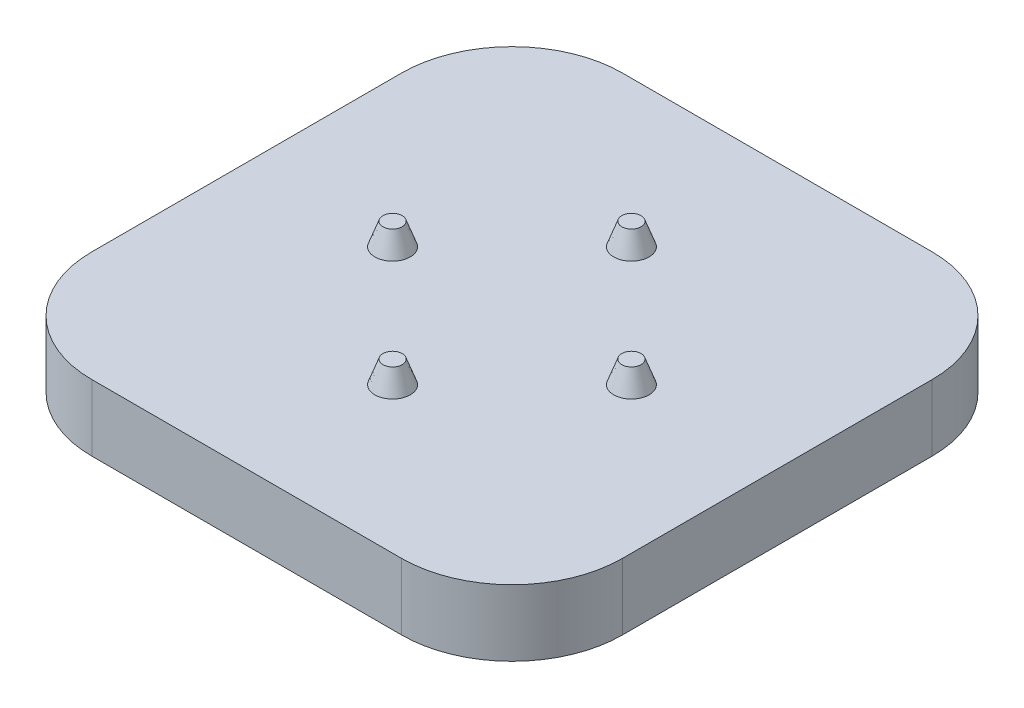
from build123d import *

# Parameters (mm, degrees)
CROQUIS2_W                        = 12
CROQUIS2_H                        = 12
PLATAFORMA_DEPTH                  = 1.5
REDONDEO3_R                       = 2.5
CROQUIS16_R                       = 0.4
SALIENTE_EXTRUIR7_DEPTH           = 0.5
SALIENTE_EXTRUIR7_DRAFT           = 20
SALIENTE_EXTRUIR7_PROFILE_2_DEPTH = 0.5
SALIENTE_EXTRUIR7_PROFILE_2_DRAFT = 20
SALIENTE_EXTRUIR7_PROFILE_3_DEPTH = 0.5
SALIENTE_EXTRUIR7_PROFILE_3_DRAFT = 20
SALIENTE_EXTRUIR7_PROFILE_4_DEPTH = 0.5
SALIENTE_EXTRUIR7_PROFILE_4_DRAFT = 20
ESCALA1_SCALE                     = 10


with BuildPart() as part:
    # Croquis2 → Plataforma (new body)
    with BuildSketch(Plane(origin=(0, 0, 0), x_dir=(1, 0, 0), z_dir=(0, 1, 0))):
        Rectangle(CROQUIS2_W, CROQUIS2_H)
    extrude(amount=PLATAFORMA_DEPTH)

    # Redondeo3
    redondeo3_edges = [part.edges().sort_by_distance(p)[0] for p in [
        (-6, 0.75, -6),
        (6, 0.75, -6),
        (6, 0.75, 6),
        (-6, 0.75, 6),
    ]]
    fillet(redondeo3_edges, radius=REDONDEO3_R)


with BuildPart() as saliente_extruir7_tool:
    # Croquis16 → Saliente-Extruir7 (with draft: the straight prism first)
    with BuildSketch(Plane(origin=(0, 1.5, 0), x_dir=(1, 0, 0), z_dir=(0, 1, 0))):
        with Locations((-2.7, 0)):
            Circle(CROQUIS16_R)
    extrude(amount=SALIENTE_EXTRUIR7_DEPTH)
    # Saliente-Extruir7: the draft: its side faces are tilted about the plane it starts from
    saliente_extruir7_sides = [saliente_extruir7_tool.faces().sort_by_distance(p)[0] for p in [
        (-3.1, 1.75, 0),
    ]]
    draft(saliente_extruir7_sides, Plane(origin=(0, 1.5, 0), x_dir=(1, 0, 0), z_dir=(0, 1, 0)), SALIENTE_EXTRUIR7_DRAFT)


with BuildPart() as part_1:
    add(part.part)

    # Saliente-Extruir7: add saliente_extruir7_tool
    add(saliente_extruir7_tool.part)


with BuildPart() as saliente_extruir7_profile_2_tool:
    # Croquis16 → Saliente-Extruir7 profile 2 (with draft: the straight prism first)
    with BuildSketch(Plane(origin=(0, 1.5, 0), x_dir=(1, 0, 0), z_dir=(0, 1, 0))):
        with Locations((0, -2.7)):
            Circle(CROQUIS16_R)
    extrude(amount=SALIENTE_EXTRUIR7_PROFILE_2_DEPTH)
    # Saliente-Extruir7 profile 2: the draft: its side faces are tilted about the plane it starts from
    saliente_extruir7_profile_2_sides = [saliente_extruir7_profile_2_tool.faces().sort_by_distance(p)[0] for p in [
        (-0.4, 1.75, 2.7),
    ]]
    draft(saliente_extruir7_profile_2_sides, Plane(origin=(0, 1.5, 0), x_dir=(1, 0, 0), z_dir=(0, 1, 0)), SALIENTE_EXTRUIR7_PROFILE_2_DRAFT)


with BuildPart() as part_2:
    add(part_1.part)

    # Saliente-Extruir7 profile 2: add saliente_extruir7_profile_2_tool
    add(saliente_extruir7_profile_2_tool.part)


with BuildPart() as saliente_extruir7_profile_3_tool:
    # Croquis16 → Saliente-Extruir7 profile 3 (with draft: the straight prism first)
    with BuildSketch(Plane(origin=(0, 1.5, 0), x_dir=(1, 0, 0), z_dir=(0, 1, 0))):
        with Locations((2.7, 0)):
            Circle(CROQUIS16_R)
    extrude(amount=SALIENTE_EXTRUIR7_PROFILE_3_DEPTH)
    # Saliente-Extruir7 profile 3: the draft: its side faces are tilted about the plane it starts from
    saliente_extruir7_profile_3_sides = [saliente_extruir7_profile_3_tool.faces().sort_by_distance(p)[0] for p in [
        (2.3, 1.75, 0),
    ]]
    draft(saliente_extruir7_profile_3_sides, Plane(origin=(0, 1.5, 0), x_dir=(1, 0, 0), z_dir=(0, 1, 0)), SALIENTE_EXTRUIR7_PROFILE_3_DRAFT)


with BuildPart() as part_3:
    add(part_2.part)

    # Saliente-Extruir7 profile 3: add saliente_extruir7_profile_3_tool
    add(saliente_extruir7_profile_3_tool.part)


with BuildPart() as saliente_extruir7_profile_4_tool:
    # Croquis16 → Saliente-Extruir7 profile 4 (with draft: the straight prism first)
    with BuildSketch(Plane(origin=(0, 1.5, 0), x_dir=(1, 0, 0), z_dir=(0, 1, 0))):
        with Locations((0, 2.7)):
            Circle(CROQUIS16_R)
    extrude(amount=SALIENTE_EXTRUIR7_PROFILE_4_DEPTH)
    # Saliente-Extruir7 profile 4: the draft: its side faces are tilted about the plane it starts from
    saliente_extruir7_profile_4_sides = [saliente_extruir7_profile_4_tool.faces().sort_by_distance(p)[0] for p in [
        (-0.4, 1.75, -2.7),
    ]]
    draft(saliente_extruir7_profile_4_sides, Plane(origin=(0, 1.5, 0), x_dir=(1, 0, 0), z_dir=(0, 1, 0)), SALIENTE_EXTRUIR7_PROFILE_4_DRAFT)


with BuildPart() as part_4:
    add(part_3.part)

    # Saliente-Extruir7 profile 4: add saliente_extruir7_profile_4_tool
    add(saliente_extruir7_profile_4_tool.part)


with BuildPart() as part_5:
    # Escala1: scaled about (0, 0.752818482, 0)
    add(part_4.part.scale(ESCALA1_SCALE).moved(Location((0, -6.775366338, 0))))


solid = part_5.part
